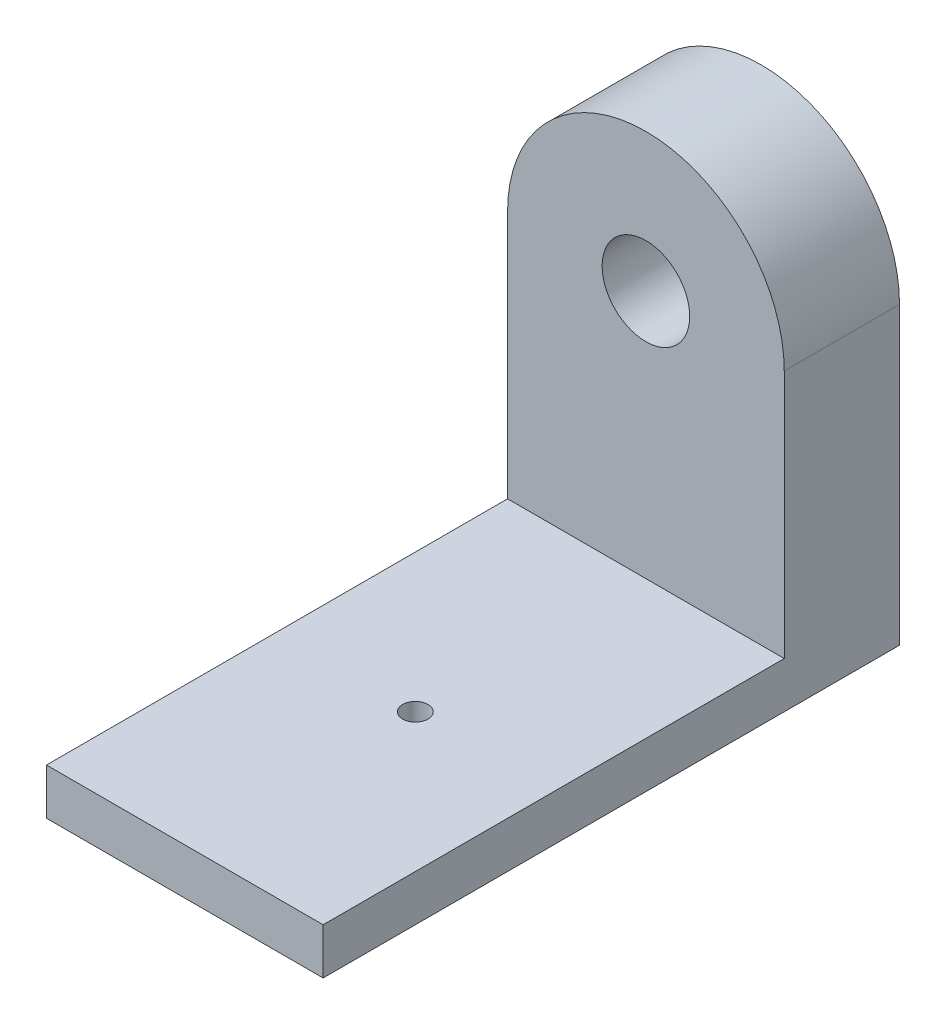
from build123d import *

# Parameters (mm, degrees)
SKETCH1_W           = 60
SKETCH1_H           = 125
BOSS_EXTRUDE1_DEPTH = 10
SKETCH2_R           = 9.5
BOSS_EXTRUDE2_DEPTH = 25
CUT_EXTRUDE1_REACH  = 164.114
SKETCH3_R           = 2.75


with BuildPart() as part:
    # Sketch1 → Boss-Extrude1 (new body)
    with BuildSketch(Plane(origin=(0, 0, 0), x_dir=(1, 0, 0), z_dir=(0, 1, 0))):
        with Locations((30, 62.5)):
            Rectangle(SKETCH1_W, SKETCH1_H)
    extrude(amount=BOSS_EXTRUDE1_DEPTH)

    # Sketch2 → Boss-Extrude2 (add)
    with BuildSketch(Plane(origin=(0, 0, -125), x_dir=(-1, 0, 0), z_dir=(0, 0, -1))):
        with BuildLine():
            Line((-60, 10), (0, 10))
            Line((0, 10), (0, 64))
            ThreePointArc((0, 64), (-30, 94), (-60, 64))
            Line((-60, 64), (-60, 10))
        make_face()
        with Locations((-30, 64)):
            Circle(SKETCH2_R, mode=Mode.SUBTRACT)
    extrude(amount=-BOSS_EXTRUDE2_DEPTH)

    # Sketch3 → Cut-Extrude1 (cut, up to next)
    with BuildSketch(Plane(origin=(0, 10, 0), x_dir=(1, 0, 0), z_dir=(0, 1, 0)), mode=Mode.PRIVATE) as cut_extrude1_sk1:
        with Locations(Location((30, 50, 0), (0, 0, 270))):
            Circle(SKETCH3_R)
    cut_extrude1_tool1 = extrude(cut_extrude1_sk1.sketch, amount=-CUT_EXTRUDE1_REACH, mode=Mode.PRIVATE) & part.part
    add(cut_extrude1_tool1.solids().sort_by_distance((30, 10, -50))[0], mode=Mode.SUBTRACT)


solid = part.part
